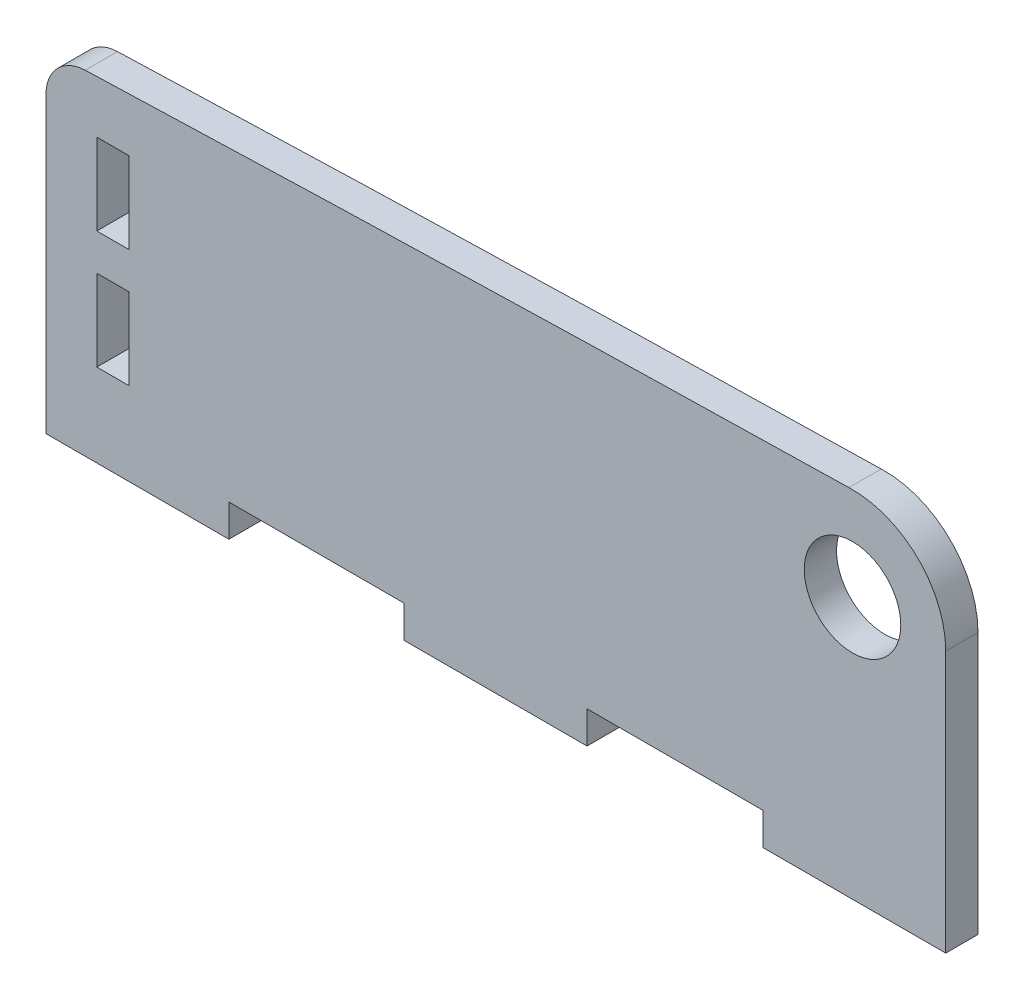
from build123d import *

# Parameters (mm, degrees)
SKETCH1_W            = 6.266
SKETCH1_H            = 19.6
SKETCH1_R            = 1.675
SKETCH1_W_2          = 52.832
SKETCH1_H_2          = 5
BOSS_EXTRUDE2_DEPTH  = 3.175
SKETCH3_W            = 30
SKETCH3_H            = 29.6
BOSS_EXTRUDE3_DEPTH  = 3.175
SKETCH4_R            = 4.75
CUT_EXTRUDE1_DEPTH   = 10
BOSS_EXTRUDE14_DEPTH = 3.175
CUT_EXTRUDE8_DEPTH   = 10
BOSS_EXTRUDE15_DEPTH = 3.175
BOSS_EXTRUDE16_DEPTH = 3.175
BOSS_EXTRUDE17_DEPTH = 3.175
FILLET5_R            = 4
SKETCH27_W           = 3.175
SKETCH27_H           = 8
CUT_EXTRUDE9_DEPTH   = 10
SKETCH28_W           = 18
SKETCH28_H           = 3.175
BOSS_EXTRUDE18_DEPTH = 3.175
SKETCH29_W           = 53.813797415
SKETCH29_H           = 23.475817665
BOSS_EXTRUDE19_DEPTH = 3.175
SKETCH30_W           = 8.216536182
SKETCH30_H           = 11.169409555
BOSS_EXTRUDE20_DEPTH = 3.175


with BuildPart() as part:
    # Sketch1 → Boss-Extrude2 (new body)
    # profile 1 of 4: a face of its own
    with BuildSketch(Plane.XY):
        with Locations((-23.283, 0)):
            Rectangle(SKETCH1_W, SKETCH1_H)
        with Locations((-23.95, -4.974)):
            Circle(SKETCH1_R, mode=Mode.SUBTRACT)
        with Locations((-23.95, 4.974)):
            Circle(SKETCH1_R, mode=Mode.SUBTRACT)
    # profile 2 of 4: a face of its own
    with BuildSketch(Plane.XY):
        with Locations((23.283, 0)):
            Rectangle(SKETCH1_W, SKETCH1_H)
        with Locations((23.95, -4.974)):
            Circle(SKETCH1_R, mode=Mode.SUBTRACT)
        with Locations((23.95, 4.974)):
            Circle(SKETCH1_R, mode=Mode.SUBTRACT)
    # profile 3 of 4: a face of its own
    with BuildSketch(Plane.XY):
        with Locations((0, 12.3)):
            Rectangle(SKETCH1_W_2, SKETCH1_H_2)
    # profile 4 of 4: a face of its own
    with BuildSketch(Plane.XY):
        with Locations((0, -12.3)):
            Rectangle(SKETCH1_W_2, SKETCH1_H_2)
    extrude(amount=BOSS_EXTRUDE2_DEPTH)

    # Sketch3 → Boss-Extrude3 (add)
    with BuildSketch(Plane.XY.offset(3.175)):
        with Locations((41.416, 0)):
            Rectangle(SKETCH3_W, SKETCH3_H)
    extrude(amount=-BOSS_EXTRUDE3_DEPTH)

    # Sketch4 → Cut-Extrude1 (cut)
    with BuildSketch(Plane(origin=(0, 0, 0), x_dir=(-1, 0, 0), z_dir=(0, 0, -1))):
        with Locations((-40.576, 7.77)):
            Circle(SKETCH4_R)
    extrude(amount=-CUT_EXTRUDE1_DEPTH, mode=Mode.SUBTRACT)

    # Sketch22 → Boss-Extrude14 (add)
    with BuildSketch(Plane(origin=(0, 0, 0), x_dir=(-1, 0, 0), z_dir=(0, 0, -1))):
        with BuildLine():
            ThreePointArc((-34.680262133, 14.8), (-40.576, 16.945), (-46.471737867, 14.8))
            Line((-46.471737867, 14.8), (-34.680262133, 14.8))
        make_face()
    extrude(amount=-BOSS_EXTRUDE14_DEPTH)

    # Sketch23 → Cut-Extrude8 (cut)
    with BuildSketch(Plane(origin=(0, 0, 0), x_dir=(-1, 0, 0), z_dir=(0, 0, -1))):
        with BuildLine():
            Line((-49.751, -14.8), (-49.751, 7.77))
            ThreePointArc((-49.751, 7.77), (-48.890866804, 11.648609936), (-46.471737867, 14.8))
            Line((-46.471737867, 14.8), (-56.416, 14.8))
            Line((-56.416, 14.8), (-56.416, -14.8))
            Line((-56.416, -14.8), (-49.751, -14.8))
        make_face()
    extrude(amount=-CUT_EXTRUDE8_DEPTH, mode=Mode.SUBTRACT)

    # Sketch24 → Boss-Extrude15 (add)
    with BuildSketch(Plane(origin=(0, 0, 0), x_dir=(-1, 0, 0), z_dir=(0, 0, -1))):
        Polygon((30.625, 14.8), (26.416, 14.8), (26.416, -14.8), (27.751006616, -14.8), (30.625, -14.8), align=None)
    extrude(amount=-BOSS_EXTRUDE15_DEPTH)

    # Sketch25 → Boss-Extrude16 (add)
    with BuildSketch(Plane(origin=(0, 0, 0), x_dir=(-1, 0, 0), z_dir=(0, 0, -1))):
        Polygon((30.625, 14.8), (30.625, 9.8), (33.8, 9.8), (33.8, 1.8), (30.625, 1.8), (30.625, -1.8), (33.8, -1.8), (33.8, -9.8), (30.625, -9.8), (30.625, -14.8), (31.879074074, -14.8), (38.8, -14.8), (38.8, 14.8), align=None)
    extrude(amount=-BOSS_EXTRUDE16_DEPTH)

    # Sketch26 → Boss-Extrude17 (add)
    with BuildSketch(Plane(origin=(0, 0, 0), x_dir=(-1, 0, 0), z_dir=(0, 0, -1))):
        with BuildLine():
            ThreePointArc((-40.225848077, 16.938316019), (-37.275108655, 16.330650754), (-34.680262133, 14.8))
            Line((-34.680262133, 14.8), (38.8, 14.8))
            ThreePointArc((38.8, 14.8), (-0.708684686, 16.025831975), (-40.225848077, 16.938316019))
        make_face()
    extrude(amount=-BOSS_EXTRUDE17_DEPTH)

    # Fillet5
    fillet5_edges = [part.edges().sort_by_distance(p)[0] for p in [
        (-38.8, 14.8, 1.5875),
    ]]
    fillet(fillet5_edges, radius=FILLET5_R)

    # Sketch27 → Cut-Extrude9 (cut)
    with BuildSketch(Plane(origin=(0, 0, 0), x_dir=(-1, 0, 0), z_dir=(0, 0, -1))):
        with Locations((-43.1635, -5.8)):
            Rectangle(SKETCH27_W, SKETCH27_H)
    extrude(amount=-CUT_EXTRUDE9_DEPTH, mode=Mode.SUBTRACT)

    # Sketch28 → Boss-Extrude18 (add)
    with BuildSketch(Plane(origin=(0, 0, 0), x_dir=(-1, 0, 0), z_dir=(0, 0, -1))):
        with Locations((-40.751, -16.3875)):
            Rectangle(SKETCH28_W, SKETCH28_H)
        with Locations((-5.45, -16.3875)):
            Rectangle(SKETCH28_W, SKETCH28_H)
        with Locations((29.8, -16.3875)):
            Rectangle(SKETCH28_W, SKETCH28_H)
    extrude(amount=-BOSS_EXTRUDE18_DEPTH)

    # Sketch29 → Boss-Extrude19 (add)
    with BuildSketch(Plane(origin=(0, 0, 0), x_dir=(-1, 0, 0), z_dir=(0, 0, -1))):
        with Locations((0.393454416, 0.74908249)):
            Rectangle(SKETCH29_W, SKETCH29_H)
    extrude(amount=-BOSS_EXTRUDE19_DEPTH)

    # Sketch30 → Boss-Extrude20 (add)
    with BuildSketch(Plane(origin=(0, 0, 0), x_dir=(-1, 0, 0), z_dir=(0, 0, -1))):
        with Locations((-41.72757997, -5.584704778)):
            Rectangle(SKETCH30_W, SKETCH30_H)
    extrude(amount=-BOSS_EXTRUDE20_DEPTH)


solid = part.part
